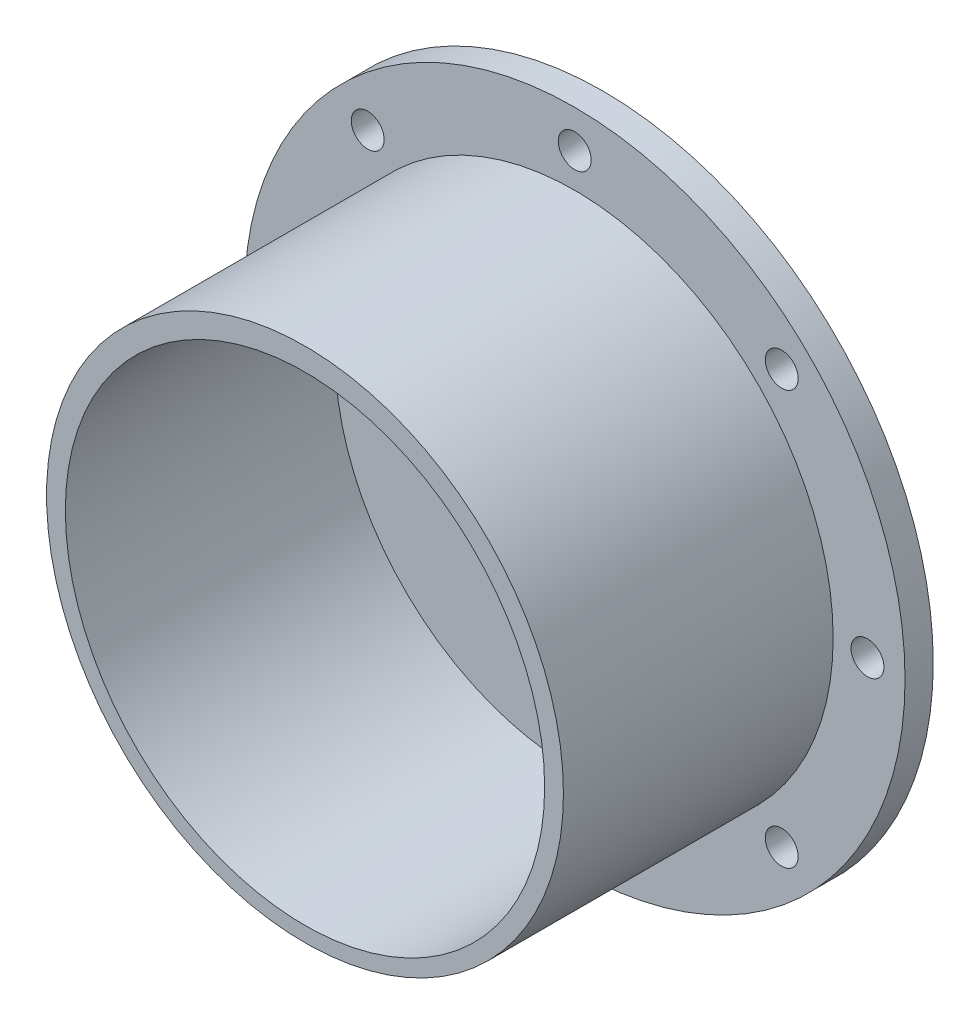
from build123d import *

# Parameters (mm, degrees)
IZIM2_R                     = 35.15
IZIM2_R_2                   = 1.75
Y_KSEKLIK_EKSTR_ZYON1_DEPTH = 3
IZIM3_R                     = 27.5
IZIM3_R_2                   = 25.5
Y_KSEKLIK_EKSTR_ZYON2_DEPTH = 28.7


with BuildPart() as part:
    # Çizim2 → Yükseklik-Ekstrüzyon1 (new body)
    with BuildSketch(Plane.XY):
        Circle(IZIM2_R)
        with Locations((0, 31.150681118)):
            Circle(IZIM2_R_2, mode=Mode.SUBTRACT)
        with Locations((22.026857857, 22.026857857)):
            Circle(IZIM2_R_2, mode=Mode.SUBTRACT)
        with Locations((31.150681118, 0)):
            Circle(IZIM2_R_2, mode=Mode.SUBTRACT)
        with Locations((22.026857857, -22.026857857)):
            Circle(IZIM2_R_2, mode=Mode.SUBTRACT)
        with Locations((0, -31.150681118)):
            Circle(IZIM2_R_2, mode=Mode.SUBTRACT)
        with Locations((-22.026857857, -22.026857857)):
            Circle(IZIM2_R_2, mode=Mode.SUBTRACT)
        with Locations((-31.150681118, 0)):
            Circle(IZIM2_R_2, mode=Mode.SUBTRACT)
        with Locations((-22.026857857, 22.026857857)):
            Circle(IZIM2_R_2, mode=Mode.SUBTRACT)
    extrude(amount=Y_KSEKLIK_EKSTR_ZYON1_DEPTH)

    # Çizim3 → Yükseklik-Ekstrüzyon2 (add)
    with BuildSketch(Plane.XY.offset(3)):
        Circle(IZIM3_R)
        with Locations((0, -0.400500668)):
            Circle(IZIM3_R_2, mode=Mode.SUBTRACT)
    extrude(amount=Y_KSEKLIK_EKSTR_ZYON2_DEPTH)


solid = part.part
